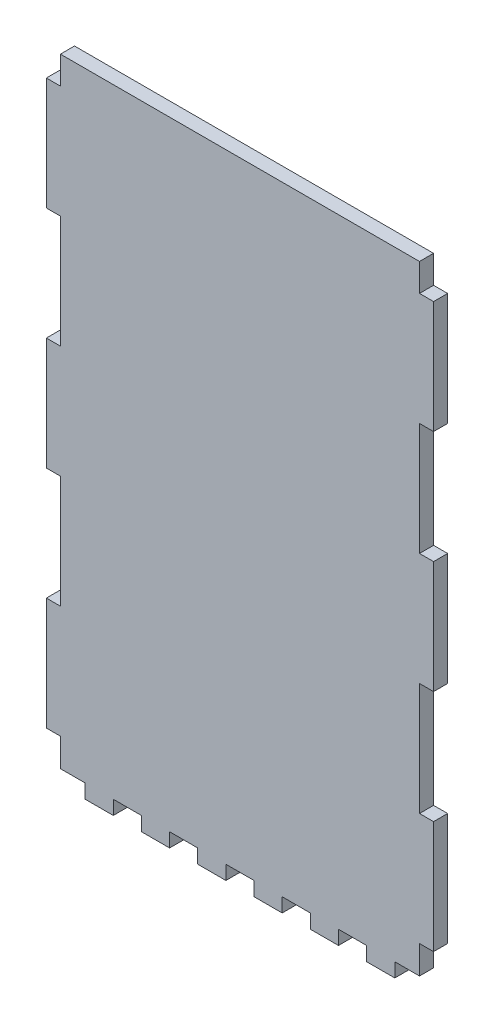
from build123d import *

# Parameters (mm, degrees)
BOSS_EXTRUDE1_DEPTH = 3.175


with BuildPart() as part:
    # Sketch1 → Boss-Extrude1 (new body)
    with BuildSketch(Plane.XY):
        Polygon((0, 3.175), (5.575, 3.175), (5.575, 0), (11.925, 0), (11.925, 3.175), (18.275, 3.175), (18.275, 0), (24.625, 0), (24.625, 3.175), (30.975, 3.175), (30.975, 0), (37.325, 0), (37.325, 3.175), (43.675, 3.175), (43.675, 0), (50.025, 0), (50.025, 3.175), (56.375, 3.175), (56.375, 0), (62.725, 0), (62.725, 3.175), (69.075, 3.175), (69.075, 0), (75.425, 0), (75.425, 3.175), (81, 3.175), (81, 9.525), (84.175, 9.525), (84.175, 34.925), (81, 34.925), (81, 60.325), (84.175, 60.325), (84.175, 85.725), (81, 85.725), (81, 111.125), (84.175, 111.125), (84.175, 136.525), (81, 136.525), (81, 142.774999946), (0, 142.774999946), (0, 136.525), (-3.175, 136.525), (-3.175, 111.125), (0, 111.125), (0, 85.725), (-3.175, 85.725), (-3.175, 60.325), (0, 60.325), (0, 34.925), (-3.175, 34.925), (-3.175, 9.525), (0, 9.525), align=None)
    extrude(amount=BOSS_EXTRUDE1_DEPTH)


solid = part.part
